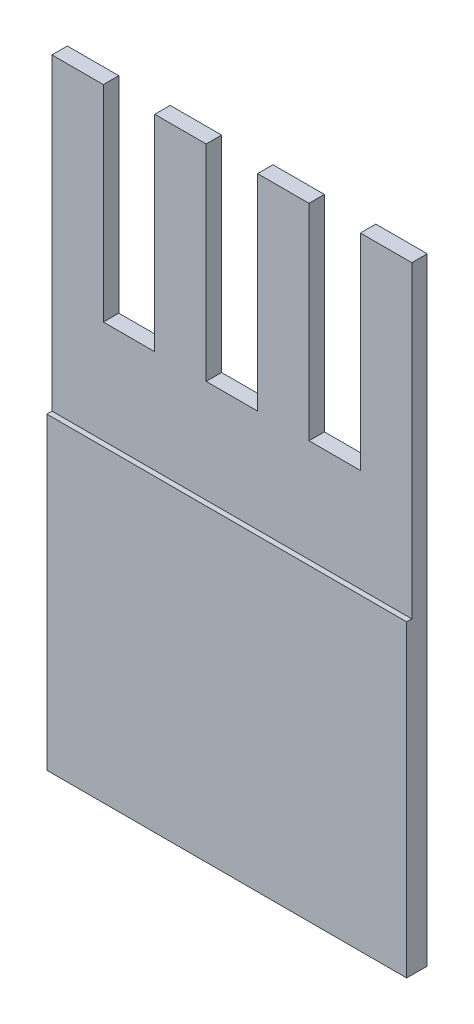
from build123d import *

# Parameters (mm, degrees)
SKETCH1_W           = 35
SKETCH1_H           = 30
BOSS_EXTRUDE5_DEPTH = 2
BOSS_EXTRUDE6_DEPTH = 1.5


with BuildPart() as part:
    # Sketch1 → Boss-Extrude5 (new body)
    with BuildSketch(Plane.XY):
        with Locations((0, -15)):
            Rectangle(SKETCH1_W, SKETCH1_H)
    extrude(amount=BOSS_EXTRUDE5_DEPTH)

    # Sketch1<7> → Boss-Extrude6 (add)
    with BuildSketch(Plane.XY):
        Polygon((-12.5, 10), (-12.5, 30), (-17.5, 30), (-17.5, 10), (-17.5, 0), (17.5, 0), (17.5, 10), (17.5, 30), (12.5, 30), (12.5, 10), (7.5, 10), (7.5, 30), (2.5, 30), (2.5, 10), (-2.5, 10), (-2.5, 30), (-7.5, 30), (-7.5, 10), align=None)
    extrude(amount=BOSS_EXTRUDE6_DEPTH)


solid = part.part
